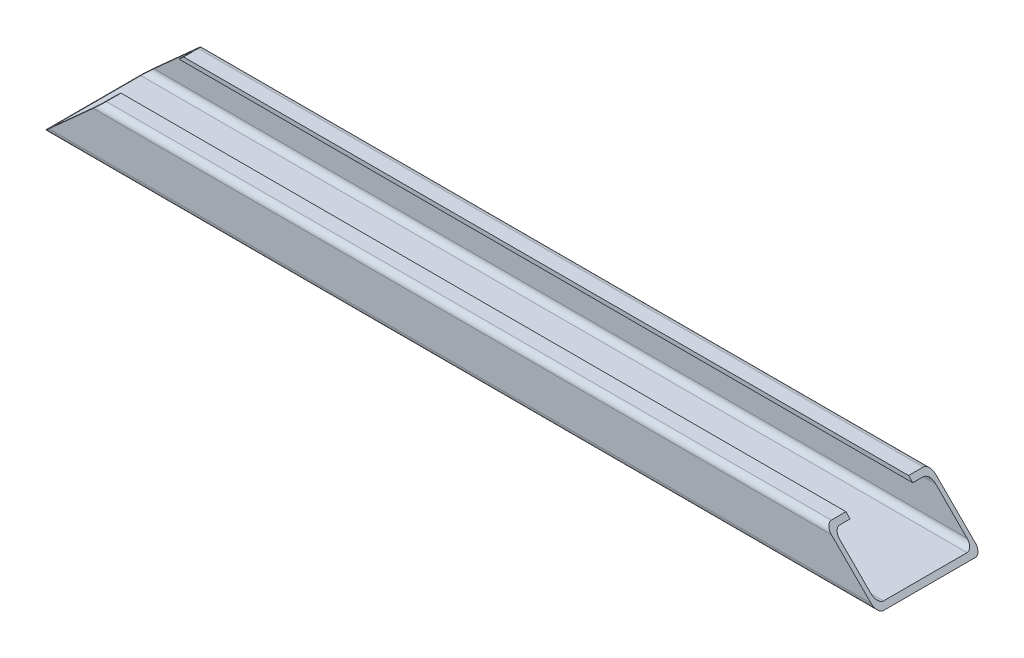
from build123d import *

# Parameters (mm, degrees)
RESSALTO_EXTRUS_O1_DEPTH = 800
FILETE1_R                = 6
CORTE_EXTRUS_O1_DEPTH    = 50
CORTE_EXTRUS_O2_DEPTH    = 50


with BuildPart() as part:
    # Esboço1 → Ressalto-extrusão1 (new body)
    with BuildSketch(Plane(origin=(0, 0, 0), x_dir=(0, 0, -1), z_dir=(1, 0, 0))):
        Polygon((-46, 21), (-46, -21), (46, -21), (46, 21), (30, 21), (30, 25), (50, 25), (50, -25), (-50, -25), (-50, 25), (-30, 25), (-30, 21), align=None)
    extrude(amount=RESSALTO_EXTRUS_O1_DEPTH)

    # Filete1
    filete1_edges = [part.edges().sort_by_distance(p)[0] for p in [
        (400, -25, -50),
        (400, -25, 50),
        (400, 25, 50),
        (400, 21, 46),
        (400, -21, 46),
        (400, -21, -46),
        (400, 21, -46),
        (400, 25, -50),
    ]]
    fillet(filete1_edges, radius=FILETE1_R)

    # Esboço3 → Corte-extrusão1 (cut, symmetric)
    with BuildSketch(Plane.XY):
        Polygon((0, -25), (184.767559257, 159.767559257), (-208.615442636, 104.939092506), align=None)
        Polygon((800, -25), (613.270955215, 161.729044785), (1063.829020425, 161.729044785), align=None)
    extrude(amount=CORTE_EXTRUS_O1_DEPTH, both=True, mode=Mode.SUBTRACT)

    # Esboço4 → Corte-extrusão2 (cut, symmetric)
    with BuildSketch(Plane.XY):
        Polygon((0, -25), (86.027500877, 52.459509711), (-33.344753199, 67.581384702), align=None)
    extrude(amount=CORTE_EXTRUS_O2_DEPTH, both=True, mode=Mode.SUBTRACT)


solid = part.part
